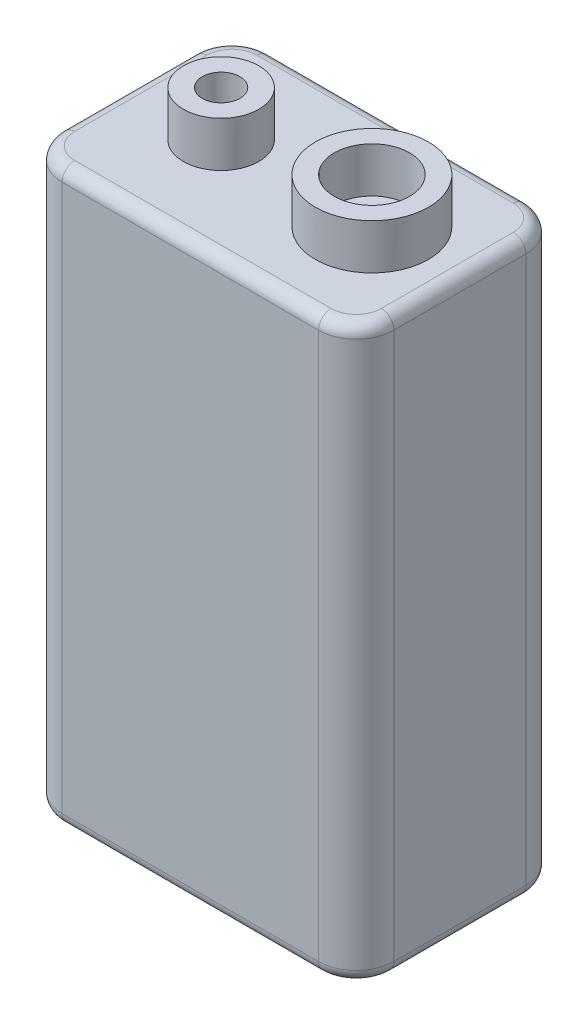
from build123d import *

# Parameters (mm, degrees)
SKETCH_1_W      = 26.4
SKETCH_1_H      = 45.5
EXTRUDE_1_DEPTH = 16.5
FILLET_1_R      = 3
SKETCH_2_R      = 3
SKETCH_2_R_2    = 1.5
SKETCH_2_R_3    = 4.5
EXTRUDE_2_DEPTH = 3.6
FILLET_2_R      = 1


with BuildPart() as part:
    # 草圖1 → 填料-伸長1 (new body)
    with BuildSketch(Plane.XY):
        with Locations((13.2, 22.75)):
            Rectangle(SKETCH_1_W, SKETCH_1_H)
    extrude(amount=EXTRUDE_1_DEPTH)

    # 圓角1
    fillet_1_edges = [part.edges().sort_by_distance(p)[0] for p in [
        (26.4, 22.75, 16.5),
        (0, 22.75, 16.5),
        (26.4, 22.75, 0),
        (0, 22.75, 0),
    ]]
    fillet(fillet_1_edges, radius=FILLET_1_R)

    # 草圖2 → 填料-伸長2 (add)
    # profile 1 of 2: a face of its own
    with BuildSketch(Plane(origin=(0, 45.5, 0), x_dir=(1, 0, 0), z_dir=(0, 1, 0))):
        with Locations(Location((7.4, -8.25, 0), (0, 0, 90))):
            Circle(SKETCH_2_R)
        with Locations(Location((7.4, -8.25, 0), (0, 0, 270))):
            Circle(SKETCH_2_R_2, mode=Mode.SUBTRACT)
    # profile 2 of 2: a face of its own
    with BuildSketch(Plane(origin=(0, 45.5, 0), x_dir=(1, 0, 0), z_dir=(0, 1, 0))):
        with Locations(Location((19.4, -8.25, 0), (0, 0, 90))):
            Circle(SKETCH_2_R_3)
        with Locations(Location((19.4, -8.25, 0), (0, 0, 270))):
            Circle(SKETCH_2_R, mode=Mode.SUBTRACT)
    extrude(amount=EXTRUDE_2_DEPTH)

    # 圓角2
    fillet_2_edges = [part.edges().sort_by_distance(p)[0] for p in [
        (0, 0, 8.25),
        (0, 45.5, 8.25),
        (13.2, 0, 0),
        (26.4, 0, 8.25),
        (13.2, 0, 16.5),
        (25.521320344, 0, 15.621320344),
        (25.521320344, 0, 0.878679656),
        (0.878679656, 0, 15.621320344),
        (0.878679656, 0, 0.878679656),
        (13.2, 45.5, 0),
        (13.2, 45.5, 16.5),
        (26.4, 45.5, 8.25),
        (25.521320344, 45.5, 15.621320344),
        (25.521320344, 45.5, 0.878679656),
        (0.878679656, 45.5, 15.621320344),
        (0.878679656, 45.5, 0.878679656),
    ]]
    fillet(fillet_2_edges, radius=FILLET_2_R)


solid = part.part
